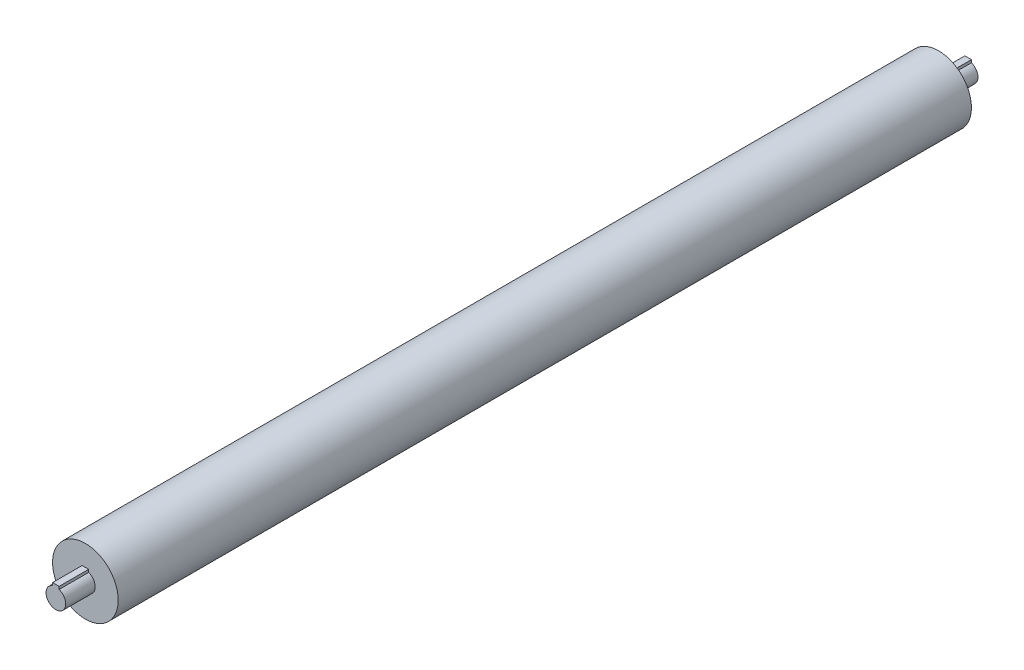
from build123d import *

# Parameters (mm, degrees)
SKETCH1_R           = 50
BOSS_EXTRUDE1_DEPTH = 650
BOSS_EXTRUDE2_DEPTH = 695


with BuildPart() as part:
    # Sketch1 → Boss-Extrude1 (new, symmetric)
    with BuildSketch(Plane.XY):
        Circle(SKETCH1_R)
    extrude(amount=BOSS_EXTRUDE1_DEPTH, both=True)

    # Sketch4 → Boss-Extrude2 (add, symmetric)
    with BuildSketch(Plane.XY):
        with BuildLine():
            Line((-5, 14.142135624), (-5, 18.3))
            Line((-5, 18.3), (5, 18.3))
            Line((5, 18.3), (5, 14.142135624))
            ThreePointArc((5, 14.142135624), (0, -15), (-5, 14.142135624))
        make_face()
    extrude(amount=BOSS_EXTRUDE2_DEPTH, both=True)


solid = part.part
